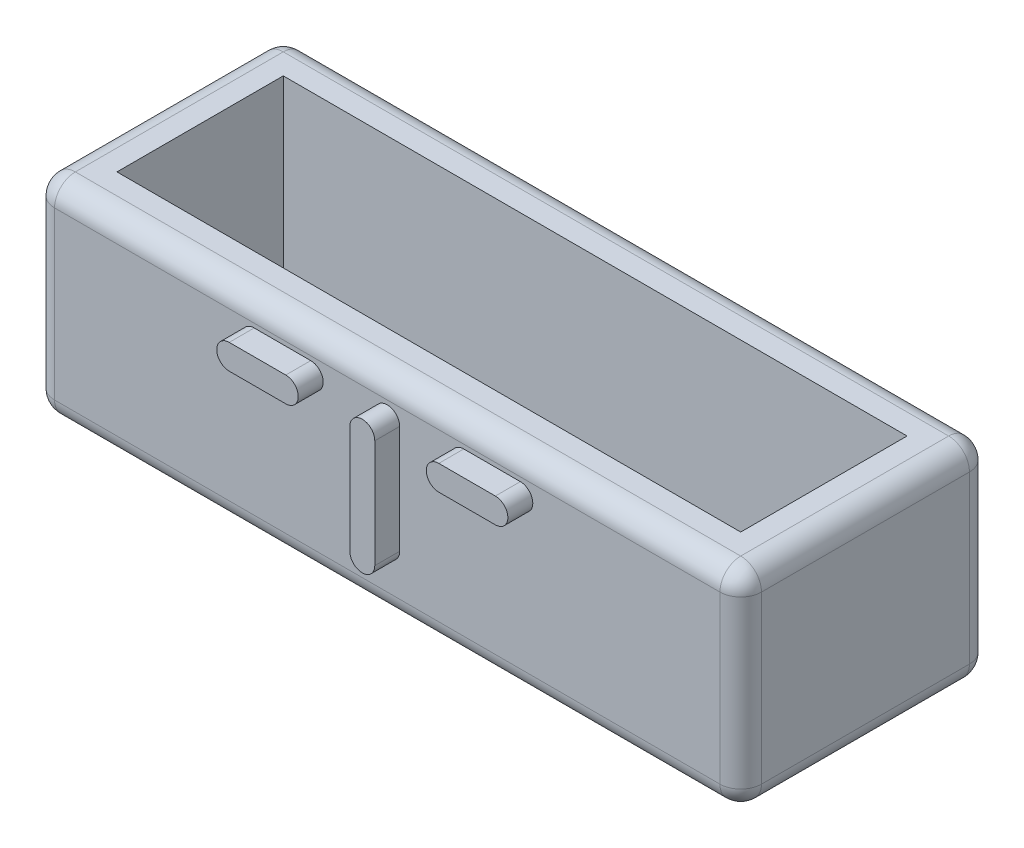
from build123d import *

# Parameters (mm, degrees)
SKETCH_1_W          = 75
SKETCH_1_H          = 20
EXTRUDE_1_DEPTH     = 20
SKETCH_2_W          = 85
SKETCH_2_H          = 30
EXTRUDE_2_DEPTH     = 25
SKETCH_3_W          = 75
SKETCH_3_H          = 20
CUT_EXTRUDE_1_DEPTH = 20
EXTRUDE_3_DEPTH     = 3
FILLET_1_R          = 2.5


with BuildPart() as part:
    # 草图1 → 凸台-拉伸1 (new body)
    with BuildSketch(Plane(origin=(0, 0, 0), x_dir=(1, 0, 0), z_dir=(0, 1, 0))):
        Rectangle(SKETCH_1_W, SKETCH_1_H)
    extrude(amount=-EXTRUDE_1_DEPTH)

    # 草图2 → 凸台-拉伸2 (add)
    with BuildSketch(Plane(origin=(0, 0, 0), x_dir=(1, 0, 0), z_dir=(0, 1, 0))):
        Rectangle(SKETCH_2_W, SKETCH_2_H)
    extrude(amount=-EXTRUDE_2_DEPTH)

    # 草图3 → 切除-拉伸1 (cut)
    with BuildSketch(Plane(origin=(0, 0, 0), x_dir=(1, 0, 0), z_dir=(0, 1, 0))):
        Rectangle(SKETCH_3_W, SKETCH_3_H)
    extrude(amount=-CUT_EXTRUDE_1_DEPTH, mode=Mode.SUBTRACT)

    # 草图5 → 凸台-拉伸3 (add)
    with BuildSketch(Plane.XY.offset(15)):
        with BuildLine():
            Line((-16, -3), (-9.2, -3))
            ThreePointArc((-9.2, -3), (-7.7, -4.5), (-9.2, -6))
            Line((-9.2, -6), (-16, -6))
            ThreePointArc((-16, -6), (-17.5, -4.5), (-16, -3))
        make_face()
        with BuildLine():
            Line((16, -3), (9.2, -3))
            ThreePointArc((9.2, -3), (7.7, -4.5), (9.2, -6))
            Line((9.2, -6), (16, -6))
            ThreePointArc((16, -6), (17.5, -4.5), (16, -3))
        make_face()
        with BuildLine():
            Line((1.5, -4.5), (1.5, -17.5))
            ThreePointArc((1.5, -17.5), (0, -19), (-1.5, -17.5))
            Line((-1.5, -17.5), (-1.5, -4.5))
            ThreePointArc((-1.5, -4.5), (0, -3), (1.5, -4.5))
        make_face()
    extrude(amount=EXTRUDE_3_DEPTH)

    # 圆角1
    fillet_1_edges = [part.edges().sort_by_distance(p)[0] for p in [
        (-42.5, -12.5, 15),
        (-42.5, -25, 0),
        (-42.5, -12.5, -15),
        (-42.5, 0, 0),
        (0, -25, 15),
        (0, -25, -15),
        (42.5, -12.5, -15),
        (42.5, -25, 0),
        (42.5, -12.5, 15),
        (42.5, 0, 0),
        (0, 0, 15),
        (0, 0, -15),
    ]]
    fillet(fillet_1_edges, radius=FILLET_1_R)


solid = part.part
